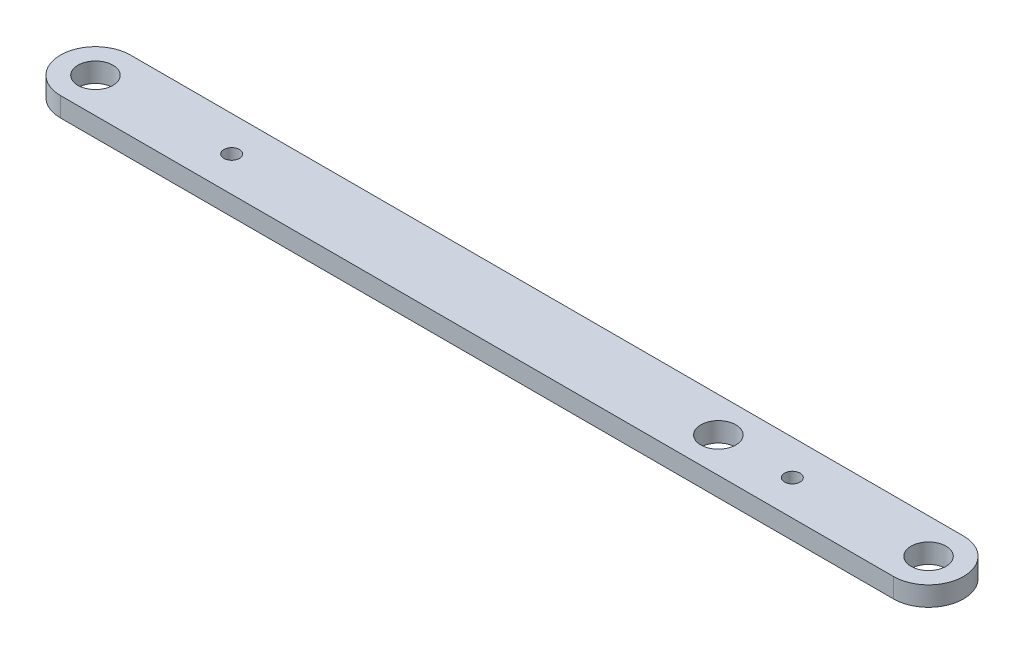
from build123d import *

# Parameters (mm, degrees)
SKETCH_1_R      = 4.5
SKETCH_1_R_2    = 2
EXTRUDE_1_DEPTH = 5


with BuildPart() as part:
    # 草图1 → 凸台-拉伸1 (new body)
    with BuildSketch(Plane(origin=(0, 0, 0), x_dir=(1, 0, 0), z_dir=(0, 1, 0))):
        with BuildLine():
            Line((-140.609734673, 23.423817863), (73.390265327, 23.423817863))
            ThreePointArc((73.390265327, 23.423817863), (82.390265327, 14.423817863), (73.390265327, 5.423817863))
            Line((73.390265327, 5.423817863), (-140.609734673, 5.423817863))
            ThreePointArc((-140.609734673, 5.423817863), (-149.609734673, 14.423817863), (-140.609734673, 23.423817863))
        make_face()
        with Locations(Location((-140.609734673, 14.423817863, 0), (0, 0, 270))):
            Circle(SKETCH_1_R, mode=Mode.SUBTRACT)
        with Locations(Location((73.390265327, 14.423817863, 0), (0, 0, 270))):
            Circle(SKETCH_1_R, mode=Mode.SUBTRACT)
        with Locations(Location((38.390265327, 14.423817863, 0), (0, 0, 270))):
            Circle(SKETCH_1_R_2, mode=Mode.SUBTRACT)
        with Locations(Location((19.390265327, 14.423817863, 0), (0, 0, 270))):
            Circle(SKETCH_1_R, mode=Mode.SUBTRACT)
        with Locations(Location((-105.609734673, 14.423817863, 0), (0, 0, 270))):
            Circle(SKETCH_1_R_2, mode=Mode.SUBTRACT)
    extrude(amount=EXTRUDE_1_DEPTH)


solid = part.part
